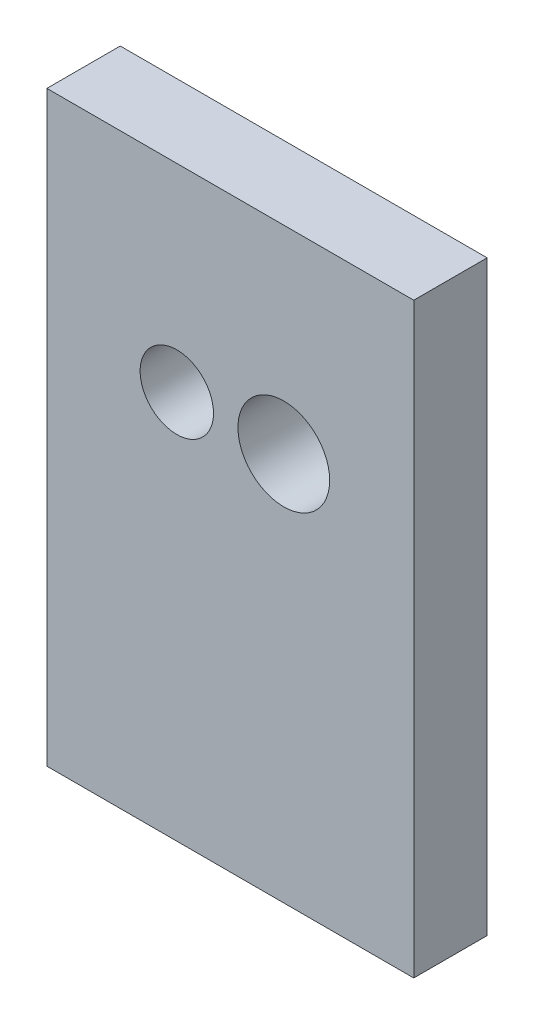
from build123d import *

# Parameters (mm, degrees)
SKETCH1_W           = 63.5
SKETCH1_H           = 134.62
SKETCH1_R           = 6.35
SKETCH1_R_2         = 7.9375
BOSS_EXTRUDE1_DEPTH = 12.7
SKETCH2_W           = 63.5
SKETCH2_H           = 33.02
CUT_EXTRUDE1_DEPTH  = 76.498268854


with BuildPart() as part:
    # Sketch1 → Boss-Extrude1 (new body)
    with BuildSketch(Plane.XY):
        Rectangle(SKETCH1_W, SKETCH1_H)
        with Locations((-9.26084, 0)):
            Circle(SKETCH1_R, mode=Mode.SUBTRACT)
        with Locations((9.26084, 0)):
            Circle(SKETCH1_R_2, mode=Mode.SUBTRACT)
    extrude(amount=BOSS_EXTRUDE1_DEPTH)

    # Sketch2 → Cut-Extrude1 (cut, through all)
    with BuildSketch(Plane.XY.offset(12.7)):
        with Locations((0, 50.8)):
            Rectangle(SKETCH2_W, SKETCH2_H)
    extrude(amount=-CUT_EXTRUDE1_DEPTH, mode=Mode.SUBTRACT)


solid = part.part
